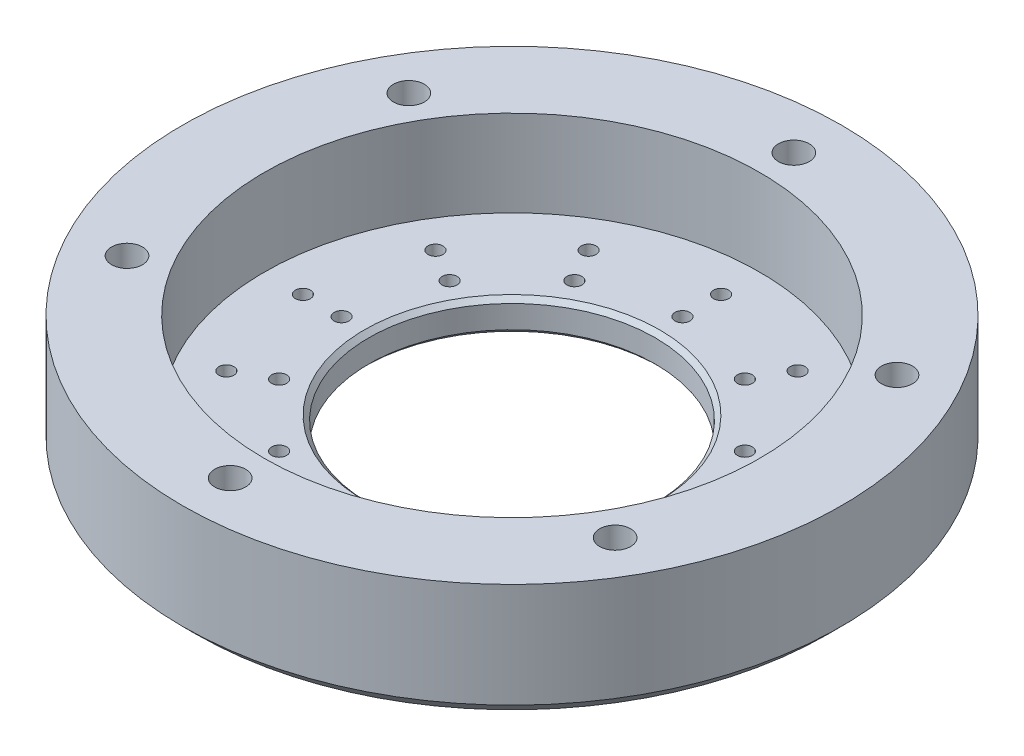
from build123d import *

# Parameters (mm, degrees)
SMUSSO1_SIZE                = 3
SMUSSO2_SIZE                = 1
RIPETIZIONECIRCOLARE1_COUNT = 6
FORO_FILETTATO_M4_1_D       = 3.3
RIPETIZIONECIRCOLARE2_COUNT = 12


with BuildPart() as part:
    # Schizzo1 → Rivoluzione1 (revolve)
    with BuildSketch(Plane.XY, mode=Mode.PRIVATE) as rivoluzione1_sk:
        Polygon((72.5, 31.559405291), (72.5, 5.559405291), (31.5, 5.559405291), (31.5, 12.559405291), (54.5, 12.559405291), (54.5, 31.559405291), align=None)
    revolve(rivoluzione1_sk.sketch.rotate(Axis((0, 82.574074074, 0), (0, -1, 0)), 90), axis=Axis((0, 82.574074074, 0), (0, -1, 0)))

    # Smusso1
    smusso1_edges = [part.edges().sort_by_distance(p)[0] for p in [
        (0, 5.559405291, -72.5),
    ]]
    chamfer(smusso1_edges, length=SMUSSO1_SIZE)

    # Smusso2
    smusso2_edges = [part.edges().sort_by_distance(p)[0] for p in [
        (0, 12.559405291, -31.5),
        (0, 5.559405291, -31.5),
    ]]
    chamfer(smusso2_edges, length=SMUSSO2_SIZE)

    # Schizzo3 → Foro filettato M8-1 (revolve, cut)
    with BuildSketch(Plane(origin=(0, 31.559405291, -62), x_dir=(0, 0, 1), z_dir=(1, 0, 0))):
        Polygon((0, 0), (0, 21.042926105), (3.4, 19), (3.4, 0), align=None)
    foro_filettato_m8_1 = revolve(axis=Axis((0, 37.909405291, -62), (0, -1, 0)), mode=Mode.SUBTRACT)

    # RipetizioneCircolare1: Foro filettato M8-1 ×6 about axis
    ripetizionecircolare1_axis = Axis((0, 0, 0), (0, 1, 0))
    for i in range(1, RIPETIZIONECIRCOLARE1_COUNT):
        add(foro_filettato_m8_1.rotate(ripetizionecircolare1_axis, i * 360 / RIPETIZIONECIRCOLARE1_COUNT), mode=Mode.SUBTRACT)

    # Foro filettato M4-1 (through all)
    with Locations(Plane(origin=(0, 12.559405291, 0), x_dir=(1, 0, 0), z_dir=(0, 1, 0))):
        with Locations((0, 46), (0, 37.5)):
            foro_filettato_m4_1 = Hole(FORO_FILETTATO_M4_1_D / 2)

    # RipetizioneCircolare2: Foro filettato M4-1 ×12 about axis
    ripetizionecircolare2_axis = Axis((0, 0, 0), (0, 1, 0))
    for i in range(1, RIPETIZIONECIRCOLARE2_COUNT):
        add(foro_filettato_m4_1.rotate(ripetizionecircolare2_axis, i * 360 / RIPETIZIONECIRCOLARE2_COUNT), mode=Mode.SUBTRACT)


solid = part.part
